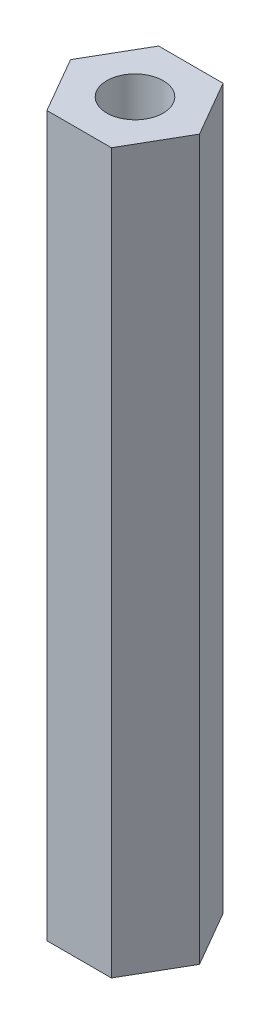
from build123d import *

# Parameters (mm, degrees)
SKETCH1_R           = 1.175
BOSS_EXTRUDE1_DEPTH = 30


with BuildPart() as part:
    # Sketch1 → Boss-Extrude1 (new body)
    with BuildSketch(Plane(origin=(0, 0, 0), x_dir=(1, 0, 0), z_dir=(0, 1, 0))):
        Polygon((2.690452254, 0), (1.345226127, 2.33), (-1.345226127, 2.33), (-2.690452254, 0), (-1.345226127, -2.33), (1.345226127, -2.33), align=None)
        with Locations(Location((0, 0, 0), (0, 0, 270))):
            Circle(SKETCH1_R, mode=Mode.SUBTRACT)
    extrude(amount=BOSS_EXTRUDE1_DEPTH)


solid = part.part
